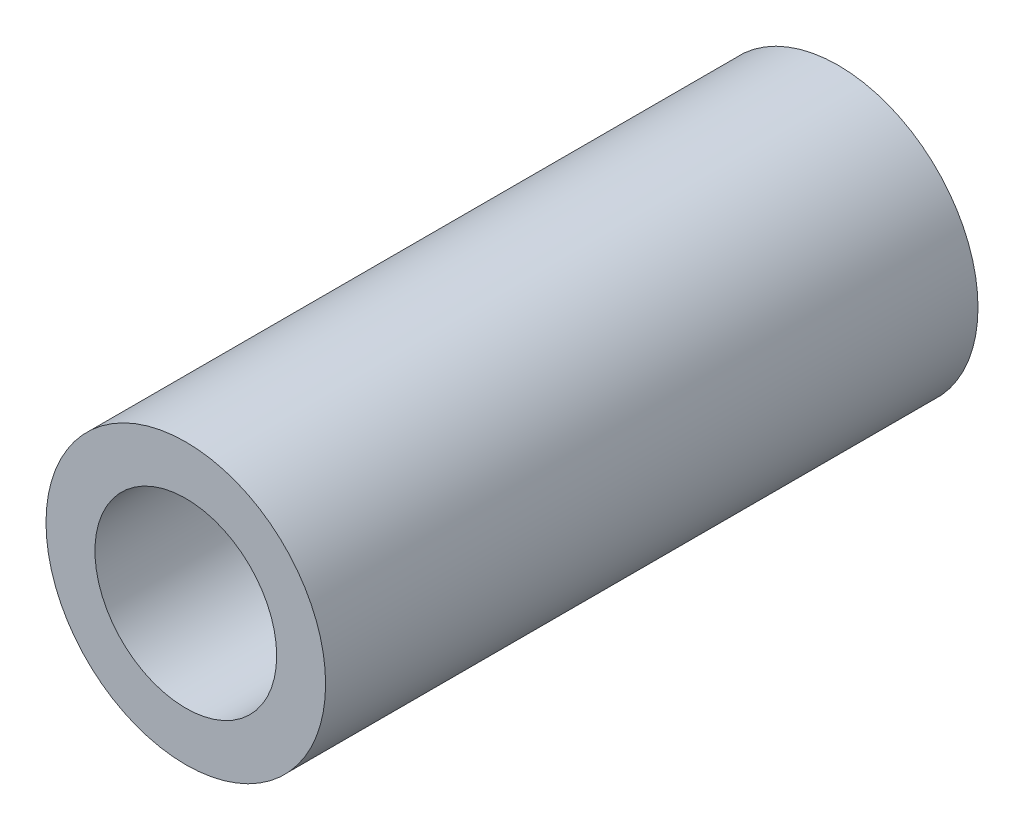
from build123d import *

# Parameters (mm, degrees)
ESQUISSE1_R             = 7.5
BOSS_EXTRU_1_DEPTH      = 35
ESQUISSE2_R             = 4.875
ENL_V_MAT_EXTRU_1_DEPTH = 16
ESQUISSE3_R             = 4.05
ENL_V_MAT_EXTRU_2_DEPTH = 16
BOSS_EXTRU_3_START      = 9
BOSS_EXTRU_3_DEPTH      = 9


with BuildPart() as part:
    # Esquisse1 → Boss.-Extru.1 (new body)
    with BuildSketch(Plane(origin=(0, 0, 0), x_dir=(0, 1, 0), z_dir=(0, 0, 1))):
        with Locations(Location((0, 0, 0), (0, 0, 270))):
            Circle(ESQUISSE1_R)
    extrude(amount=BOSS_EXTRU_1_DEPTH)

    # Esquisse2 → Enlèv. mat.-Extru.1 (cut)
    with BuildSketch(Plane.XY.offset(35)):
        Circle(ESQUISSE2_R)
    extrude(amount=-ENL_V_MAT_EXTRU_1_DEPTH, mode=Mode.SUBTRACT)

    # Esquisse3 → Enlèv. mat.-Extru.2 (cut)
    with BuildSketch(Plane(origin=(0, 0, 0), x_dir=(1, 0, 0), z_dir=(0, 0, -1))):
        with Locations(Location((0, 0, 0), (0, 0, 180))):
            Circle(ESQUISSE3_R)
    extrude(amount=-ENL_V_MAT_EXTRU_2_DEPTH, mode=Mode.SUBTRACT)

    # Esquisse5 → Boss.-Extru.3 (add)
    with BuildSketch(Plane(origin=(0, 0, 16), x_dir=(1, 0, 0), z_dir=(0, 0, -1)).offset(BOSS_EXTRU_3_START)):
        with BuildLine():
            Line((-2.822041762, 2.904923458), (3.200496338, 2.481798378))
            ThreePointArc((3.200496338, 2.481798378), (0.283840932, 4.040041377), (-2.822041762, 2.904923458))
        make_face()
    extrude(amount=-BOSS_EXTRU_3_DEPTH)


solid = part.part
